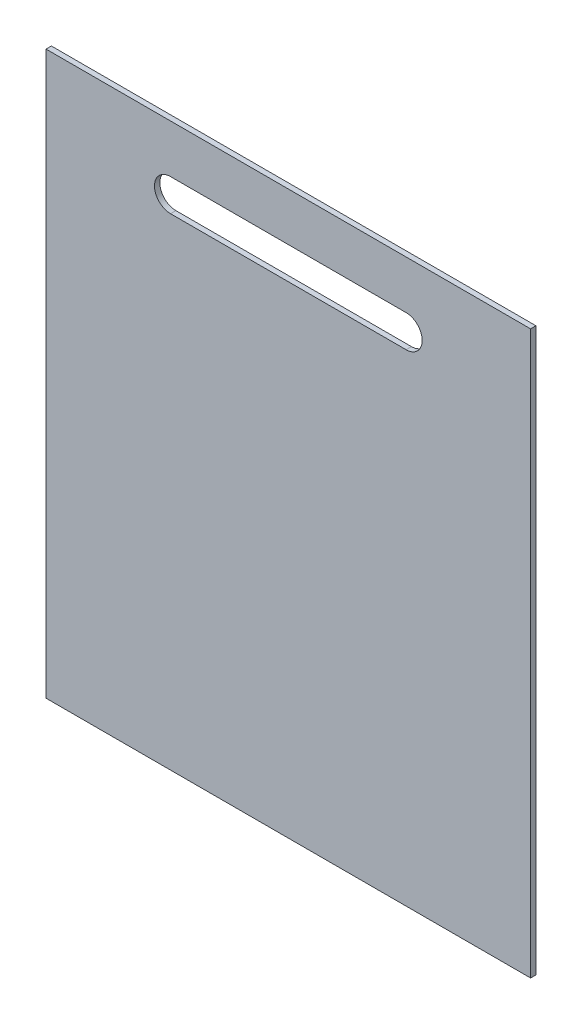
from build123d import *

# Parameters (mm, degrees)
SKETCH_1_W      = 452.5
SKETCH_1_H      = 525
EXTRUDE_1_DEPTH = 5


with BuildPart() as part:
    # 草图1 → 凸台-拉伸1 (new body)
    with BuildSketch(Plane.XY):
        Rectangle(SKETCH_1_W, SKETCH_1_H)
        with BuildLine():
            Line((-110, 217.5), (110, 217.5))
            ThreePointArc((110, 217.5), (125, 202.5), (110, 187.5))
            Line((110, 187.5), (-110, 187.5))
            ThreePointArc((-110, 187.5), (-125, 202.5), (-110, 217.5))
        make_face(mode=Mode.SUBTRACT)
    extrude(amount=EXTRUDE_1_DEPTH)


solid = part.part
